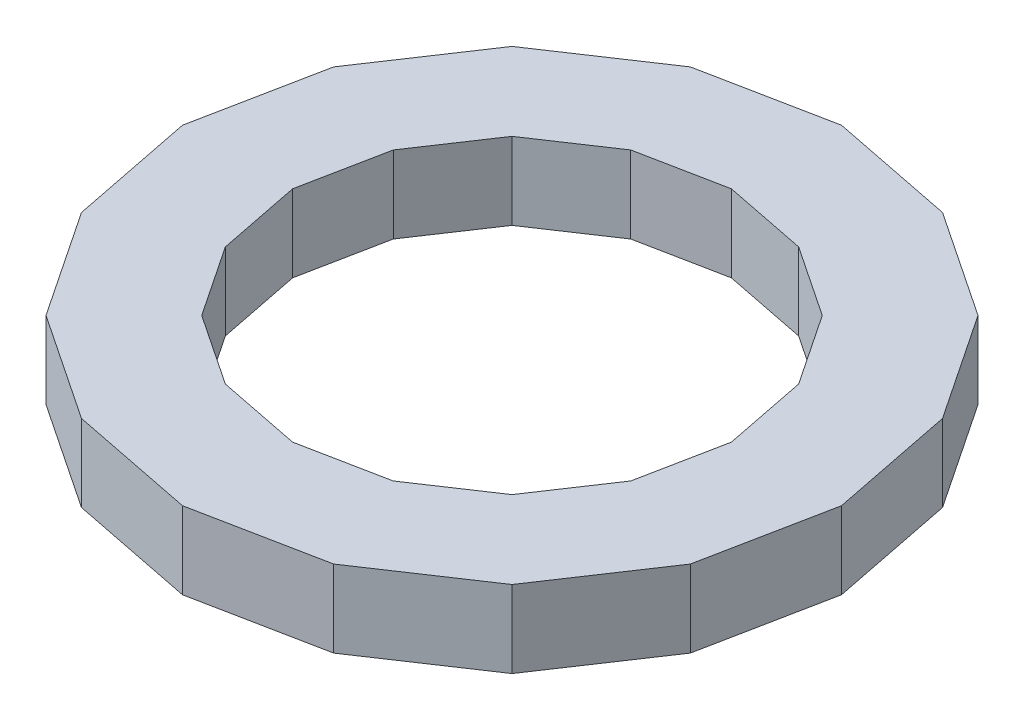
from build123d import *

# Parameters (mm, degrees)
BOSS_EXTRUDE2_DEPTH = 19.05


with BuildPart() as part:
    # Sketch2 → Boss-Extrude2 (new body)
    with BuildSketch(Plane(origin=(0, 0, 0), x_dir=(1, 0, 0), z_dir=(0, 1, 0))):
        Polygon((-81.372565466, 0), (-75.178447742, -31.139932653), (-57.539092843, -57.539092843), (-31.139932653, -75.178447742), (0, -81.372565466), (31.139932653, -75.178447742), (57.539092843, -57.539092843), (75.178447742, -31.139932653), (81.372565466, 0), (75.178447742, 31.139932653), (57.539092843, 57.539092843), (31.139932653, 75.178447742), (0, 81.372565466), (-31.139932653, 75.178447742), (-57.539092843, 57.539092843), (-75.178447742, 31.139932653), align=None)
        Polygon((-54.180069276, 0), (-50.055857074, -20.733814876), (-38.31109439, -38.31109439), (-20.733814876, -50.055857074), (0, -54.180069276), (20.733814876, -50.055857074), (38.31109439, -38.31109439), (50.055857074, -20.733814876), (54.180069276, 0), (50.055857074, 20.733814876), (38.31109439, 38.31109439), (20.733814876, 50.055857074), (0, 54.180069276), (-20.733814876, 50.055857074), (-38.31109439, 38.31109439), (-50.055857074, 20.733814876), align=None, mode=Mode.SUBTRACT)
    extrude(amount=BOSS_EXTRUDE2_DEPTH)


solid = part.part
